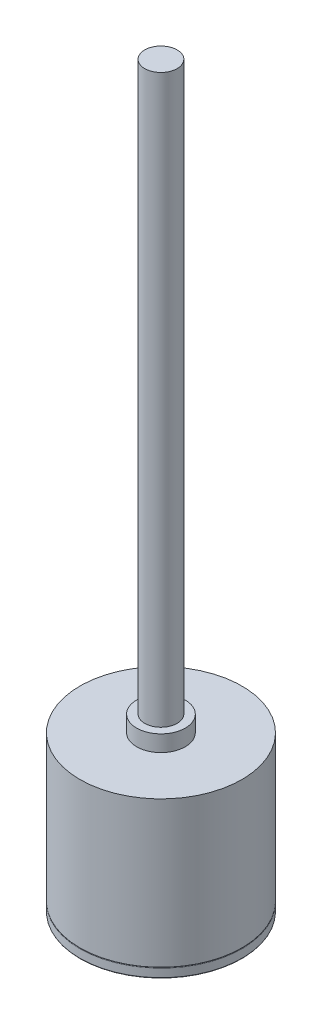
from build123d import *

# Parameters (mm, degrees)
SKETCH_1_R      = 5
EXTRUDE_1_DEPTH = 0.6
FILLET_1_R      = 0.05
FILLET_2_R      = 0.05
SKETCH_2_R      = 5
EXTRUDE_2_DEPTH = 9
SKETCH_3_R      = 1.5
EXTRUDE_3_DEPTH = 1
SKETCH_4_R      = 1
EXTRUDE_4_DEPTH = 35


with BuildPart() as part:
    # 草图1 → 凸台-拉伸1 (new body)
    with BuildSketch(Plane(origin=(0, 0, 0), x_dir=(1, 0, 0), z_dir=(0, 1, 0))):
        Circle(SKETCH_1_R)
    extrude(amount=EXTRUDE_1_DEPTH)

    # 圆角1
    fillet_1_edges = [part.edges().sort_by_distance(p)[0] for p in [
        (-5, 0.6, 0),
    ]]
    fillet(fillet_1_edges, radius=FILLET_1_R)

    # 圆角2
    fillet_2_edges = [part.edges().sort_by_distance(p)[0] for p in [
        (-5, 0, 0),
    ]]
    fillet(fillet_2_edges, radius=FILLET_2_R)

    # 草图2 → 凸台-拉伸2 (add)
    with BuildSketch(Plane(origin=(0, 0.6, 0), x_dir=(1, 0, 0), z_dir=(0, 1, 0))):
        Circle(SKETCH_2_R)
    extrude(amount=EXTRUDE_2_DEPTH)

    # 草图3 → 凸台-拉伸3 (add)
    with BuildSketch(Plane(origin=(0, 9.6, 0), x_dir=(1, 0, 0), z_dir=(0, 1, 0))):
        Circle(SKETCH_3_R)
    extrude(amount=EXTRUDE_3_DEPTH)

    # 草图4 → 凸台-拉伸4 (add)
    with BuildSketch(Plane(origin=(0, 10.6, 0), x_dir=(1, 0, 0), z_dir=(0, 1, 0))):
        Circle(SKETCH_4_R)
    extrude(amount=EXTRUDE_4_DEPTH)


solid = part.part
